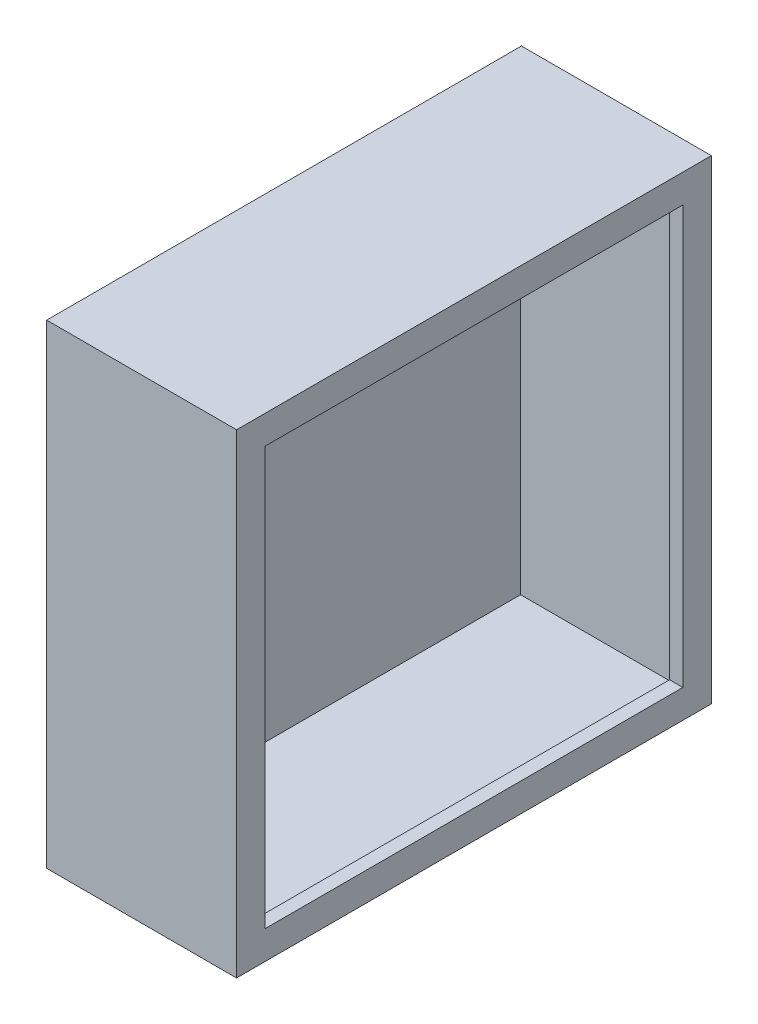
from build123d import *

# Parameters (mm, degrees)
SKETCH_1_W          = 100
SKETCH_1_H          = 100
EXTRUDE_1_DEPTH     = 40
SKETCH_36_W         = 94
SKETCH_36_H         = 94
CUT_EXTRUDE_2_DEPTH = 37
SKETCH_4_W          = 3
SKETCH_4_H          = 88
EXTRUDE_6_DEPTH     = 6
SKETCH_52_W         = 2.795133155
SKETCH_52_H         = 88
EXTRUDE_7_DEPTH     = 6
EXTRUDE_9_DEPTH     = 6
SKETCH_57_W         = 2.795133155
SKETCH_57_H         = 94
EXTRUDE_10_DEPTH    = 6


with BuildPart() as part:
    # 草图1 → 凸台-拉伸1 (new body)
    with BuildSketch(Plane(origin=(0, 0, 0), x_dir=(0, 0, -1), z_dir=(1, 0, 0))):
        with Locations((6.345177665, 10.178154254)):
            Rectangle(SKETCH_1_W, SKETCH_1_H)
    extrude(amount=EXTRUDE_1_DEPTH)

    # 草图36 → 切除-拉伸2 (cut)
    with BuildSketch(Plane(origin=(40, 0, 0), x_dir=(0, 0, -1), z_dir=(1, 0, 0))):
        with Locations((6.163819268, 10.178154254)):
            Rectangle(SKETCH_36_W, SKETCH_36_H)
    extrude(amount=-CUT_EXTRUDE_2_DEPTH, mode=Mode.SUBTRACT)

    # 草图4 → 凸台-拉伸6 (add)
    with BuildSketch(Plane.XY.offset(43.654822335)):
        with Locations((38.5, 10.178154254)):
            Rectangle(SKETCH_4_W, SKETCH_4_H)
    extrude(amount=-EXTRUDE_6_DEPTH)

    # 草图52 → 凸台-拉伸7 (add)
    with BuildSketch(Plane(origin=(0, 0, -56.345177665), x_dir=(-1, 0, 0), z_dir=(0, 0, -1))):
        with Locations((-38.602433422, 10.178154254)):
            Rectangle(SKETCH_52_W, SKETCH_52_H)
    extrude(amount=-EXTRUDE_7_DEPTH)

    # 草图56 → 凸台-拉伸9 (add)
    with BuildSketch(Plane.XZ.offset(39.821845746)):
        Polygon((40, 40.836180732), (37.204866845, 40.836180732), (37.204866845, -53.163819268), (40, -53.163819268), (40, -50.345177665), align=None)
    extrude(amount=-EXTRUDE_9_DEPTH)

    # 草图57 → 凸台-拉伸10 (add)
    with BuildSketch(Plane(origin=(0, 60.178154254, 0), x_dir=(1, 0, 0), z_dir=(0, 1, 0))):
        with Locations((38.602433422, 6.163819268)):
            Rectangle(SKETCH_57_W, SKETCH_57_H)
    extrude(amount=-EXTRUDE_10_DEPTH)


solid = part.part
